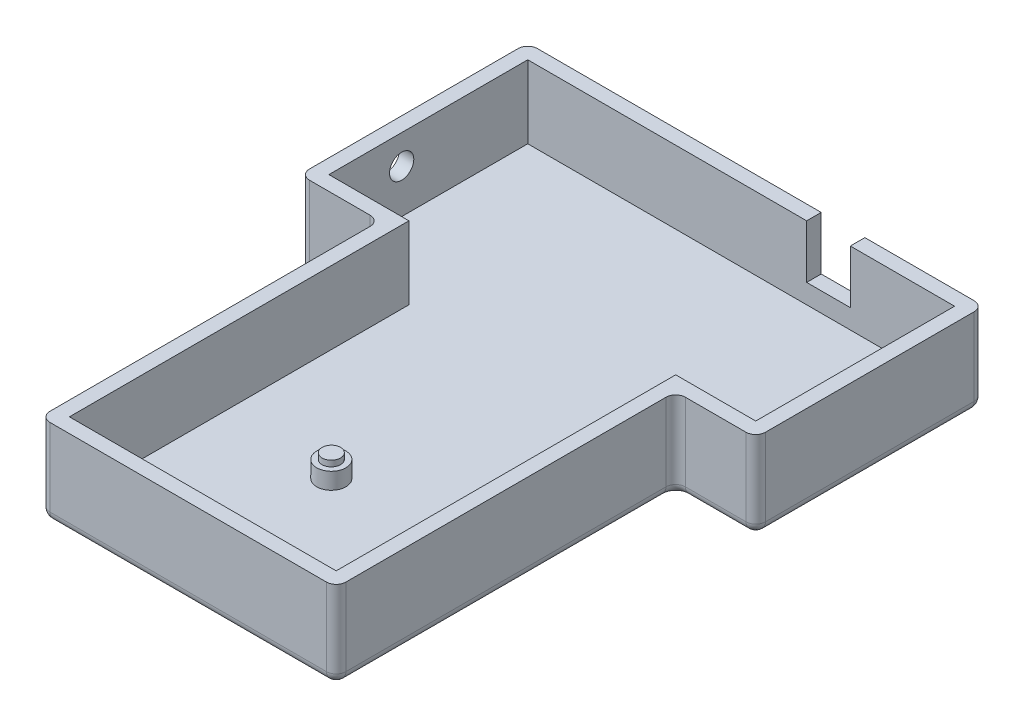
from build123d import *

# Parameters (mm, degrees)
BOSS_EXTRUDE1_DEPTH = 15
SHELL1_T            = 3
SKETCH3_W           = 9
SKETCH3_H           = 11
CUT_EXTRUDE1_DEPTH  = 3
SKETCH4_R           = 2.5
CUT_EXTRUDE2_DEPTH  = 3
FILLET1_R           = 2
SKETCH5_R           = 3
BOSS_EXTRUDE2_DEPTH = 3.4
SKETCH6_R           = 1.9
BOSS_EXTRUDE3_DEPTH = 1.2


with BuildPart() as part:
    # Sketch1 → Boss-Extrude1 (new body)
    with BuildSketch(Plane(origin=(0, 0, 0), x_dir=(1, 0, 0), z_dir=(0, 1, 0))):
        Polygon((0, 0), (88, 0), (88, -41), (71.5, -41), (71.5, -111), (16.5, -111), (16.5, -41), (0, -41), align=None)
    extrude(amount=BOSS_EXTRUDE1_DEPTH)

    # Shell1
    shell1_openings = [part.faces().sort_by_distance(p)[0] for p in [
        (44, 15, 49.150442478),
    ]]
    offset(amount=SHELL1_T, openings=shell1_openings, kind=Kind.INTERSECTION)

    # Sketch3 → Cut-Extrude1 (cut)
    with BuildSketch(Plane(origin=(0, 0, -3), x_dir=(-1, 0, 0), z_dir=(0, 0, -1))):
        with Locations((-62, 9.5)):
            Rectangle(SKETCH3_W, SKETCH3_H)
    extrude(amount=-CUT_EXTRUDE1_DEPTH, mode=Mode.SUBTRACT)

    # Sketch4 → Cut-Extrude2 (cut)
    with BuildSketch(Plane.ZY.offset(3)):
        with Locations((26, 9)):
            Circle(SKETCH4_R)
    extrude(amount=-CUT_EXTRUDE2_DEPTH, mode=Mode.SUBTRACT)

    # Fillet1
    fillet1_edges = [part.edges().sort_by_distance(p)[0] for p in [
        (44, -3, 114),
        (13.5, -3, 79),
        (5.25, -3, 44),
        (-3, -3, 20.5),
        (-3, 6, -3),
        (91, 6, -3),
        (91, 6, 44),
        (74.5, 6, 44),
        (74.5, 6, 114),
        (13.5, 6, 114),
        (13.5, 6, 44),
        (-3, 6, 44),
        (44, -3, -3),
        (91, -3, 20.5),
        (82.75, -3, 44),
        (74.5, -3, 79),
    ]]
    fillet(fillet1_edges, radius=FILLET1_R)

    # Sketch5 → Boss-Extrude2 (add)
    with BuildSketch(Plane(origin=(0, 0, 0), x_dir=(1, 0, 0), z_dir=(0, 1, 0))):
        with Locations(Location((39.5, -80, 0), (0, 0, 90))):
            Circle(SKETCH5_R)
        with Locations(Location((79.5, -20, 0), (0, 0, 90))):
            Circle(SKETCH5_R)
    extrude(amount=BOSS_EXTRUDE2_DEPTH)

    # Sketch6 → Boss-Extrude3 (add)
    with BuildSketch(Plane(origin=(0, 3.4, 0), x_dir=(1, 0, 0), z_dir=(0, 1, 0))):
        with Locations(Location((39.5, -80, 0), (0, 0, 270))):
            Circle(SKETCH6_R)
        with Locations(Location((79.5, -20, 0), (0, 0, 270))):
            Circle(SKETCH6_R)
    extrude(amount=BOSS_EXTRUDE3_DEPTH)


solid = part.part
